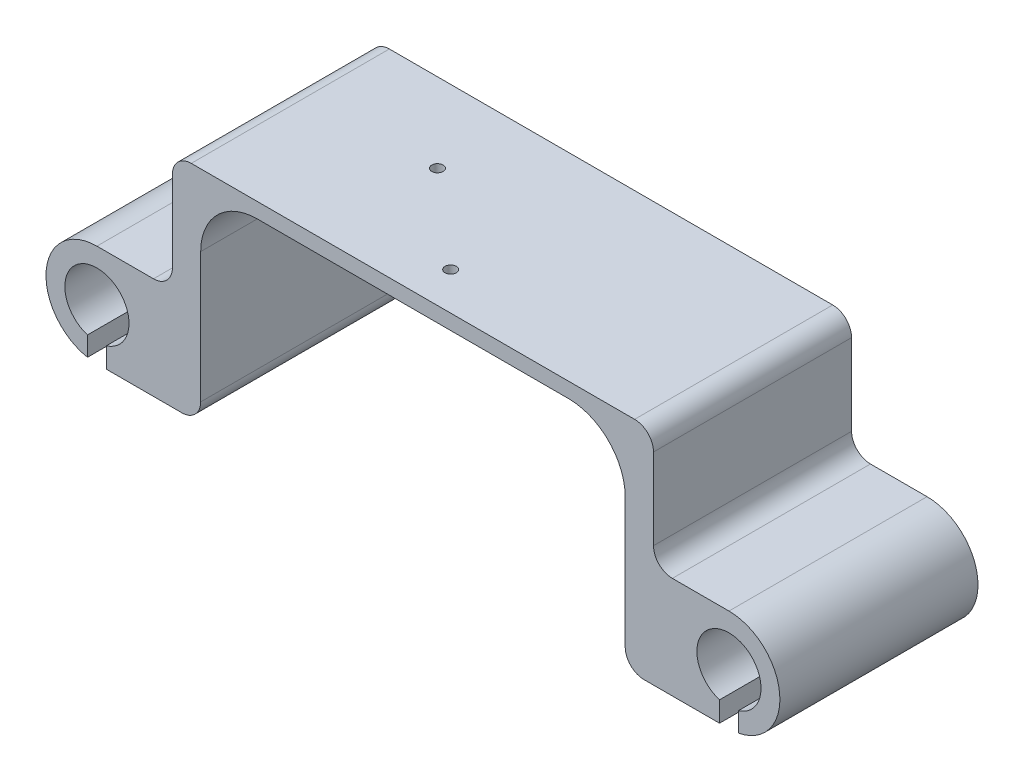
from build123d import *

# Parameters (mm, degrees)
SKETCH1_R           = 1.905
BOSS_EXTRUDE1_DEPTH = 26.67
CUT_EXTRUDE1_DEPTH  = 22.86
SKETCH8_W           = 57.15
SKETCH8_H           = 26.67
CUT_EXTRUDE4_DEPTH  = 1.778
SKETCH6_R           = 2.54
BOSS_EXTRUDE3_DEPTH = 2.54
SKETCH7_R           = 0.762
CUT_EXTRUDE3_DEPTH  = 7.62
FILLET1_R           = 2.54
FILLET4_R           = 7.62
SKETCH9_R           = 2.54
BOSS_EXTRUDE4_DEPTH = 2.54
FILLET3_R           = 1.27


with BuildPart() as part:
    # Sketch1 → Boss-Extrude1 (new body)
    with BuildSketch(Plane.XY):
        with BuildLine():
            Line((10.16, 22.86), (74.93, 22.86))
            Line((74.93, 22.86), (74.93, 6.858))
            Line((74.93, 6.858), (85.09, 6.858))
            ThreePointArc((85.09, 6.858), (91.948, 0), (85.09, -6.858))
            Line((85.09, -6.858), (71.12, -6.858))
            Line((71.12, -6.858), (71.12, -4.572))
            Line((71.12, -4.572), (71.12, 19.05))
            Line((71.12, 19.05), (42.545, 19.05))
            Line((42.545, 19.05), (13.97, 19.05))
            Line((13.97, 19.05), (13.97, -4.572))
            Line((13.97, -4.572), (13.97, -6.858))
            Line((13.97, -6.858), (0, -6.858))
            ThreePointArc((0, -6.858), (-6.858, 0), (0, 6.858))
            Line((0, 6.858), (10.16, 6.858))
            Line((10.16, 6.858), (10.16, 22.86))
        make_face()
        Circle(SKETCH1_R, mode=Mode.SUBTRACT)
        with Locations((85.09, 0)):
            Circle(SKETCH1_R, mode=Mode.SUBTRACT)
    extrude(amount=-BOSS_EXTRUDE1_DEPTH)

    # Sketch3 → Cut-Extrude1 (cut)
    with BuildSketch(Plane.XY):
        with BuildLine():
            Line((83.82, -4.12701151), (83.82, -6.858))
            Line((83.82, -6.858), (85.09, -6.858))
            ThreePointArc((85.09, -6.858), (85.727763736, -6.828281), (86.36, -6.739381574))
            Line((86.36, -6.739381574), (86.36, -4.12701151))
            ThreePointArc((86.36, -4.12701151), (85.09, 4.318), (83.82, -4.12701151))
        make_face()
        with BuildLine():
            Line((-1.27, -4.12701151), (-1.27, -6.739381574))
            ThreePointArc((-1.27, -6.739381574), (-0.637763736, -6.828281), (0, -6.858))
            Line((0, -6.858), (1.27, -6.858))
            Line((1.27, -6.858), (1.27, -4.12701151))
            ThreePointArc((1.27, -4.12701151), (0, 4.318), (-1.27, -4.12701151))
        make_face()
    extrude(amount=-CUT_EXTRUDE1_DEPTH, mode=Mode.SUBTRACT)

    # Sketch8 → Cut-Extrude4 (cut)
    with BuildSketch(Plane(origin=(0, 19.05, 0), x_dir=(-1, 0, 0), z_dir=(0, -1, 0))):
        with Locations((-42.545, 13.335)):
            Rectangle(SKETCH8_W, SKETCH8_H)
    extrude(amount=-CUT_EXTRUDE4_DEPTH, mode=Mode.SUBTRACT)

    # Sketch6 → Boss-Extrude3 (add)
    with BuildSketch(Plane(origin=(0, 20.828, 0), x_dir=(-1, 0, 0), z_dir=(0, -1, 0))):
        with Locations(Location((-42.545, 5.08, 0), (0, 0, 90))):
            Circle(SKETCH6_R)
        with Locations(Location((-29.845, 16.002, 0), (0, 0, 90))):
            Circle(SKETCH6_R)
    extrude(amount=BOSS_EXTRUDE3_DEPTH)

    # Sketch7 → Cut-Extrude3 (cut)
    with BuildSketch(Plane(origin=(0, 18.288, 0), x_dir=(-1, 0, 0), z_dir=(0, -1, 0))):
        with Locations(Location((-42.545, 5.08, 0), (0, 0, 90))):
            Circle(SKETCH7_R)
        with Locations(Location((-29.845, 16.002, 0), (0, 0, 90))):
            Circle(SKETCH7_R)
    extrude(amount=-CUT_EXTRUDE3_DEPTH, mode=Mode.SUBTRACT)

    # Fillet1
    fillet1_edges = [part.edges().sort_by_distance(p)[0] for p in [
        (10.16, 6.858, -13.335),
        (10.16, 22.86, -13.335),
        (74.93, 22.86, -13.335),
        (74.93, 6.858, -13.335),
        (71.12, -6.858, -13.335),
        (13.97, -6.858, -13.335),
    ]]
    fillet(fillet1_edges, radius=FILLET1_R)

    # Fillet4
    fillet4_edges = [part.edges().sort_by_distance(p)[0] for p in [
        (71.12, 20.828, -13.335),
        (13.97, 20.828, -13.335),
    ]]
    fillet(fillet4_edges, radius=FILLET4_R)

    # Sketch9 → Boss-Extrude4 (add)
    with BuildSketch(Plane(origin=(0, 20.828, 0), x_dir=(-1, 0, 0), z_dir=(0, -1, 0))):
        with Locations(Location((-52.705, 16.002, 0), (0, 0, 90))):
            Circle(SKETCH9_R)
    extrude(amount=BOSS_EXTRUDE4_DEPTH)

    # Fillet3
    fillet3_edges = [part.edges().sort_by_distance(p)[0] for p in [
        (42.545, 20.828, -2.54),
        (29.845, 20.828, -13.462),
        (52.705, 20.828, -13.462),
    ]]
    fillet(fillet3_edges, radius=FILLET3_R)


solid = part.part
